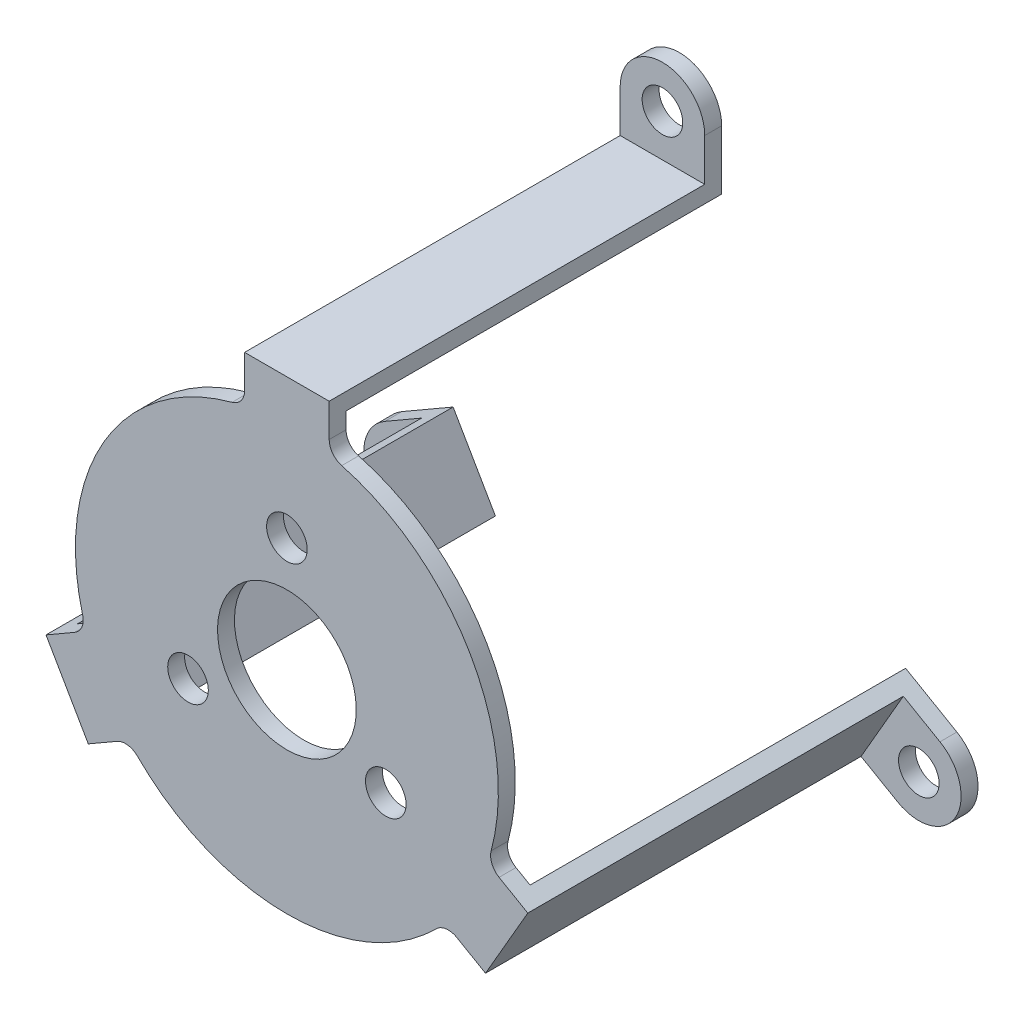
from build123d import *

# Parameters (mm, degrees)
ESBO_O1_R                = 4.1
ESBO_O1_R_2              = 1.2
RESSALTO_EXTRUS_O1_DEPTH = 1
ESBO_O2_W                = 5
ESBO_O2_H                = 1
RESSALTO_EXTRUS_O2_DEPTH = 22.2
ESBO_O3_R                = 1.2
RESSALTO_EXTRUS_O3_DEPTH = 1
FILETE1_R                = 1
BODY_MOVE_COPY2_ANGLE    = 90


with BuildPart() as part:
    # Esboço1 → Ressalto-extrusão1 (new body)
    with BuildSketch(Plane(origin=(0, 0, 0), x_dir=(1, 0, 0), z_dir=(0, 1, 0))):
        with BuildLine():
            Line((-2.5, 15), (-2.5, 12.247448714))
            ThreePointArc((-2.5, 12.247448714), (-10.825317547, 6.25), (-11.856601718, -3.958660847))
            Line((-11.856601718, -3.958660847), (-14.240381057, -5.334936491))
            Line((-14.240381057, -5.334936491), (-11.740381057, -9.665063509))
            Line((-11.740381057, -9.665063509), (-9.356601718, -8.288787866))
            ThreePointArc((-9.356601718, -8.288787866), (0, -12.5), (9.356601718, -8.288787866))
            Line((9.356601718, -8.288787866), (11.740381057, -9.665063509))
            Line((11.740381057, -9.665063509), (14.240381057, -5.334936491))
            Line((14.240381057, -5.334936491), (11.856601718, -3.958660847))
            ThreePointArc((11.856601718, -3.958660847), (10.825317547, 6.25), (2.5, 12.247448714))
            Line((2.5, 12.247448714), (2.5, 15))
            Line((2.5, 15), (-2.5, 15))
        make_face()
        with Locations(Location((0, 0, 0), (0, 0, 270))):
            Circle(ESBO_O1_R, mode=Mode.SUBTRACT)
        with Locations(Location((0, 6.75, 0), (0, 0, 270))):
            Circle(ESBO_O1_R_2, mode=Mode.SUBTRACT)
        with Locations(Location((5.845671476, -3.375, 0), (0, 0, 270))):
            Circle(ESBO_O1_R_2, mode=Mode.SUBTRACT)
        with Locations(Location((-5.845671476, -3.375, 0), (0, 0, 270))):
            Circle(ESBO_O1_R_2, mode=Mode.SUBTRACT)
    extrude(amount=RESSALTO_EXTRUS_O1_DEPTH)

    # Esboço2 → Ressalto-extrusão2 (add)
    with BuildSketch(Plane.XZ):
        with Locations((0, -14.5)):
            Rectangle(ESBO_O2_W, ESBO_O2_H)
        Polygon((-10.874355653, 9.165063509), (-11.740381057, 9.665063509), (-14.240381057, 5.334936491), (-13.374355653, 4.834936491), align=None)
        Polygon((13.374355653, 4.834936491), (14.240381057, 5.334936491), (11.740381057, 9.665063509), (10.874355653, 9.165063509), align=None)
    extrude(amount=RESSALTO_EXTRUS_O2_DEPTH)

    # Esboço3 → Ressalto-extrusão3 (add)
    # profile 1 of 3: a face of its own
    with BuildSketch(Plane.XZ.offset(22.2)):
        with BuildLine():
            Line((2.5, -15), (2.5, -17.5))
            ThreePointArc((2.5, -17.5), (0, -20), (-2.5, -17.5))
            Line((-2.5, -17.5), (-2.5, -15))
            Line((-2.5, -15), (2.5, -15))
        make_face()
        with Locations(Location((0, -17.5, 0), (0, 0, 270))):
            Circle(ESBO_O3_R, mode=Mode.SUBTRACT)
    # profile 2 of 3: a face of its own
    with BuildSketch(Plane.XZ.offset(22.2)):
        with BuildLine():
            Line((-11.740381057, 9.665063509), (-13.905444566, 10.915063509))
            ThreePointArc((-13.905444566, 10.915063509), (-17.320508076, 10), (-16.405444566, 6.584936491))
            Line((-16.405444566, 6.584936491), (-14.240381057, 5.334936491))
            Line((-14.240381057, 5.334936491), (-11.740381057, 9.665063509))
        make_face()
        with Locations(Location((-15.155444566, 8.75, 0), (0, 0, 270))):
            Circle(ESBO_O3_R, mode=Mode.SUBTRACT)
    # profile 3 of 3: a face of its own
    with BuildSketch(Plane.XZ.offset(22.2)):
        with BuildLine():
            Line((14.240381057, 5.334936491), (16.405444566, 6.584936491))
            ThreePointArc((16.405444566, 6.584936491), (17.320508076, 10), (13.905444566, 10.915063509))
            Line((13.905444566, 10.915063509), (11.740381057, 9.665063509))
            Line((11.740381057, 9.665063509), (14.240381057, 5.334936491))
        make_face()
        with Locations(Location((15.155444566, 8.75, 0), (0, 0, 270))):
            Circle(ESBO_O3_R, mode=Mode.SUBTRACT)
    extrude(amount=-RESSALTO_EXTRUS_O3_DEPTH)

    # Filete1
    filete1_edges = [part.edges().sort_by_distance(p)[0] for p in [
        (11.856601718, 0.5, 3.958660847),
        (2.5, 0.5, -12.247448714),
        (-2.5, 0.5, -12.247448714),
        (-11.856601718, 0.5, 3.958660847),
        (9.356601718, 0.5, 8.288787866),
        (-9.356601718, 0.5, 8.288787866),
    ]]
    fillet(filete1_edges, radius=FILETE1_R)


with BuildPart() as part_1:
    # Body-Move/Copy2: moved
    add(part.part.rotate(Axis((0, -10.6, -3.75), (1, 0, 0)), BODY_MOVE_COPY2_ANGLE))


solid = part_1.part
